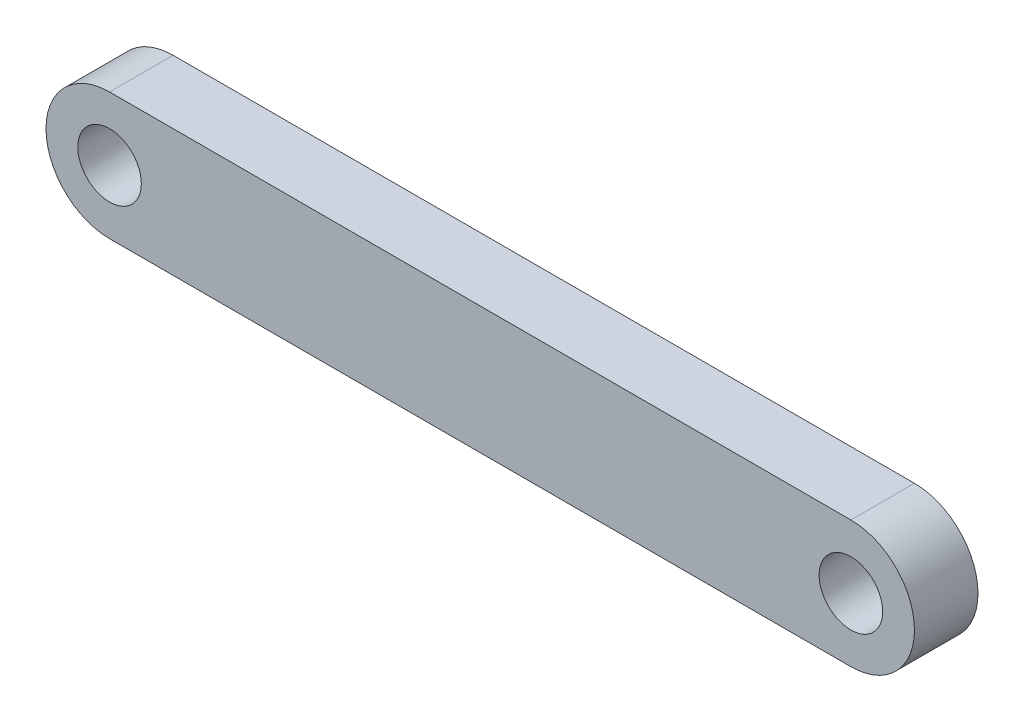
from build123d import *

# Parameters (mm, degrees)
SKETCH2_R           = 1.5
BOSS_EXTRUDE1_DEPTH = 3


with BuildPart() as part:
    # Sketch2 → Boss-Extrude1 (new body)
    with BuildSketch(Plane.XY):
        with BuildLine():
            Line((-35, 3), (0, 3))
            ThreePointArc((0, 3), (3, 0), (0, -3))
            Line((0, -3), (-35, -3))
            ThreePointArc((-35, -3), (-38, 0), (-35, 3))
        make_face()
        with Locations((-35, 0)):
            Circle(SKETCH2_R, mode=Mode.SUBTRACT)
        Circle(SKETCH2_R, mode=Mode.SUBTRACT)
    extrude(amount=BOSS_EXTRUDE1_DEPTH)


solid = part.part
